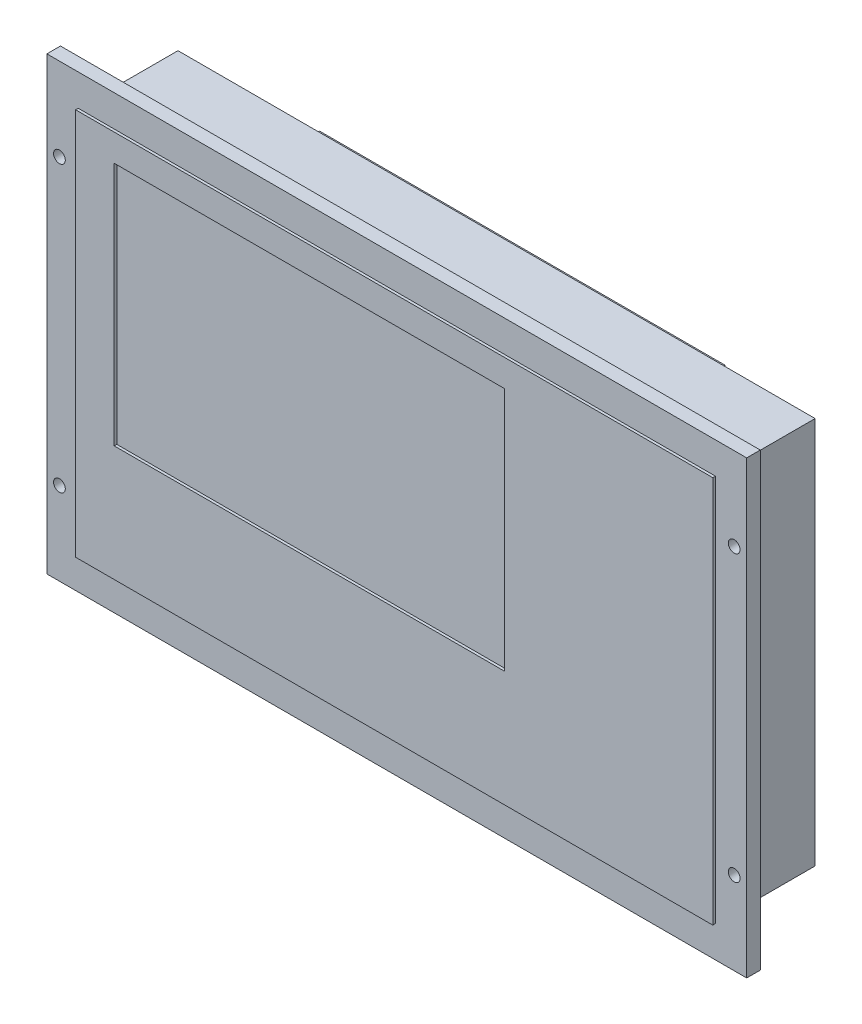
from build123d import *

# Parameters (mm, degrees)
SKETCH2_W                = 268
SKETCH2_H                = 172.5
BOSS_EXTRUDE2_DEPTH      = 5.2
BOSS_EXTRUDE1_DEPTH      = 6.2
BOSS_EXTRUDE1_DEPTH_BACK = 33
SKETCH1_W                = 244
SKETCH1_H                = 148.4
M4_CLEARANCE_HOLE1_D     = 4.5
SKETCH6_W                = 149.557953786
SKETCH6_H                = 93.729813504
CUT_EXTRUDE1_DEPTH       = 1
SKETCH7_W                = 10.202720683
SKETCH7_H                = 115.902906959
SKETCH7_W_2              = 155.285408795
SKETCH7_H_2              = 10.202720683
SKETCH7_W_3              = 157.734061759
SKETCH7_H_3              = 10.61082951
BOSS_EXTRUDE3_DEPTH      = 10


with BuildPart() as part:
    # Sketch2 → Boss-Extrude2 (new body)
    with BuildSketch(Plane.XY):
        Rectangle(SKETCH2_W, SKETCH2_H)
    extrude(amount=BOSS_EXTRUDE2_DEPTH)

    # Sketch1 → Boss-Extrude1 (add, two sides: drawn at the far end of the back side and taken through both)
    with BuildSketch(Plane.XY.offset(-BOSS_EXTRUDE1_DEPTH_BACK)):
        Rectangle(SKETCH1_W, SKETCH1_H)
    extrude(amount=BOSS_EXTRUDE1_DEPTH + BOSS_EXTRUDE1_DEPTH_BACK)

    # M4 Clearance Hole1 (through all)
    with Locations(Plane(origin=(0, 0, 0), x_dir=(-1, 0, 0), z_dir=(0, 0, -1))):
        with Locations((-129.2, 54.5), (129.2, -54.5), (129.2, 54.5), (-129.2, -54.5)):
            Hole(M4_CLEARANCE_HOLE1_D / 2)

    # Sketch6 → Cut-Extrude1 (cut)
    with BuildSketch(Plane.XY.offset(6.2)):
        with Locations((-32.438368972, 16.987461646)):
            Rectangle(SKETCH6_W, SKETCH6_H)
    extrude(amount=-CUT_EXTRUDE1_DEPTH, mode=Mode.SUBTRACT)

    # Sketch7 → Boss-Extrude3 (add)
    with BuildSketch(Plane(origin=(0, 0, -33), x_dir=(-1, 0, 0), z_dir=(0, 0, -1))):
        with Locations((-98.57020546, 0.991507772)):
            Rectangle(SKETCH7_W, SKETCH7_H)
        with Locations((0.090103545, 59.555124492)):
            Rectangle(SKETCH7_W_2, SKETCH7_H_2)
        with Locations((4.579300645, -53.899129503)):
            Rectangle(SKETCH7_W_3, SKETCH7_H_3)
    extrude(amount=BOSS_EXTRUDE3_DEPTH)


solid = part.part
